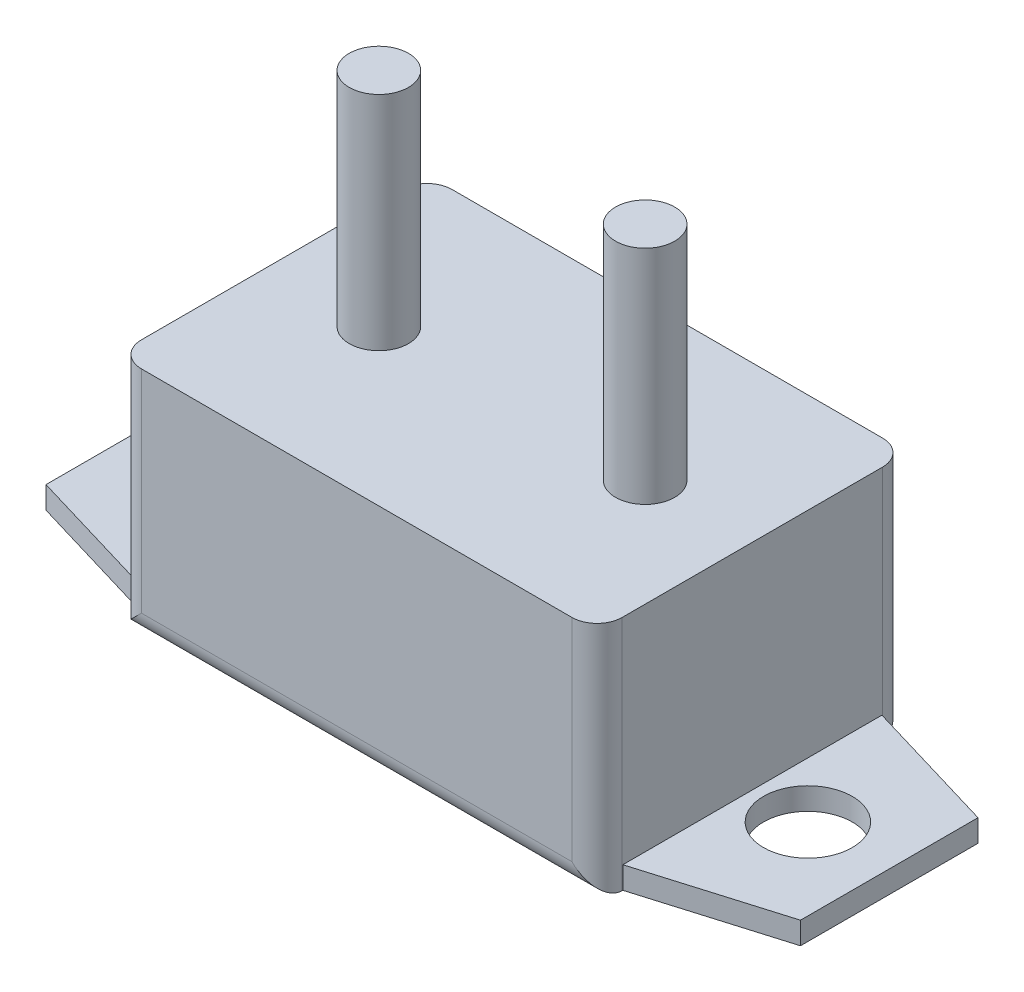
from build123d import *

# Parameters (mm, degrees)
CROQUIS1_W              = 32.5
CROQUIS1_H              = 21
SALIENTE_EXTRUIR1_DEPTH = 16
CROQUIS2_R              = 2
SALIENTE_EXTRUIR2_DEPTH = 15
CROQUIS3_R              = 3
SALIENTE_EXTRUIR3_DEPTH = 1.5
REDONDEO1_R             = 1.7


with BuildPart() as part:
    # Croquis1 → Saliente-Extruir1 (new body)
    with BuildSketch(Plane(origin=(0, 0, 0), x_dir=(1, 0, 0), z_dir=(0, 1, 0))):
        Rectangle(CROQUIS1_W, CROQUIS1_H)
    extrude(amount=SALIENTE_EXTRUIR1_DEPTH)

    # Croquis2 → Saliente-Extruir2 (add)
    with BuildSketch(Plane(origin=(0, 16, 0), x_dir=(1, 0, 0), z_dir=(0, 1, 0))):
        with Locations(Location((-9, 0, 0), (0, 0, 270))):
            Circle(CROQUIS2_R)
        with Locations(Location((9, 0, 0), (0, 0, 90))):
            Circle(CROQUIS2_R)
    extrude(amount=SALIENTE_EXTRUIR2_DEPTH)

    # Croquis3 → Saliente-Extruir3 (add)
    # profile 1 of 2: a face of its own
    with BuildSketch(Plane.XZ):
        Polygon((-16.25, 8.754302239), (-25.5, 6), (-25.5, -6), (-16.25, -8.754302239), align=None)
        with Locations(Location((-20, 0, 0), (0, 0, 270))):
            Circle(CROQUIS3_R, mode=Mode.SUBTRACT)
    # profile 2 of 2: a face of its own
    with BuildSketch(Plane.XZ):
        Polygon((16.25, -8.754302239), (25.5, -6), (25.5, 6), (16.25, 8.754302239), align=None)
        with Locations(Location((20, 0, 0), (0, 0, 90))):
            Circle(CROQUIS3_R, mode=Mode.SUBTRACT)
    extrude(amount=-SALIENTE_EXTRUIR3_DEPTH)

    # Redondeo1
    redondeo1_edges = [part.edges().sort_by_distance(p)[0] for p in [
        (0, 0, 10.5),
        (0, 0, -10.5),
        (16.25, 8, 10.5),
        (-16.25, 8, 10.5),
        (-16.25, 8, -10.5),
        (16.25, 8, -10.5),
    ]]
    fillet(redondeo1_edges, radius=REDONDEO1_R)


solid = part.part
